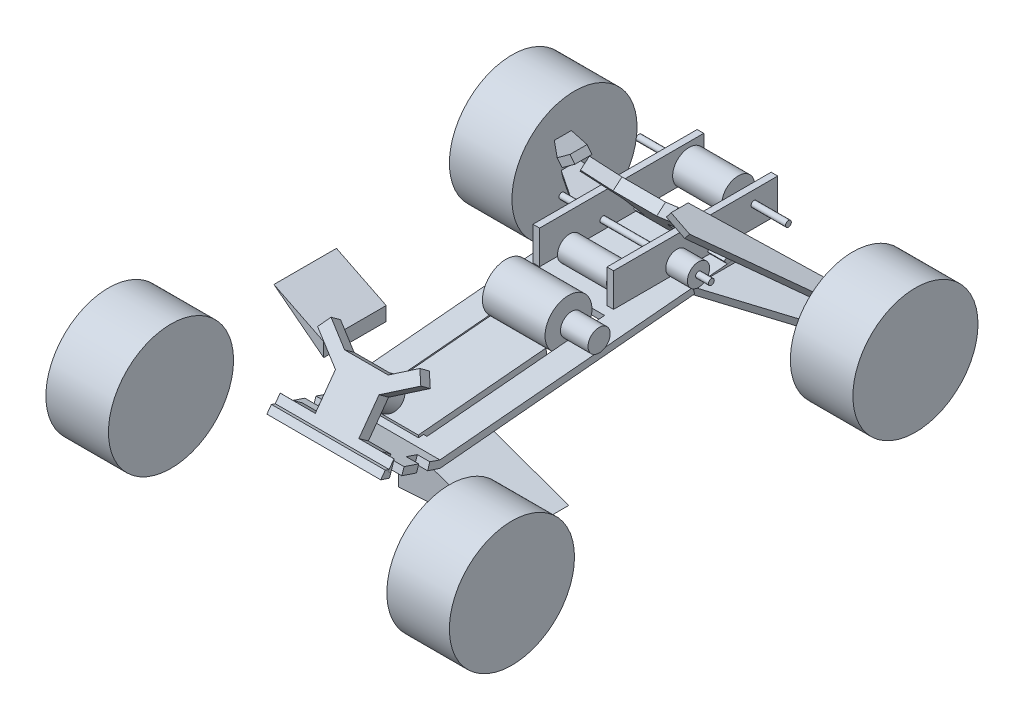
from build123d import *

# Parameters (mm, degrees)
EXTRUDE8_DEPTH    = 50.8
EXTRUDE8_2_DEPTH  = 50.8
EXTRUDE9_START    = 38.1
EXTRUDE9_DEPTH    = 6.35
EXTRUDE10_START   = -111.76
EXTRUDE10_DEPTH   = 6.35
EXTRUDE1_START    = 113.03
SKETCH1_R         = 50.8
EXTRUDE1_DEPTH    = 50.8
EXTRUDE3_DEPTH    = 46.228
EXTRUDE4_START    = -12.7
EXTRUDE4_DEPTH    = 9.525
EXTRUDE5_DEPTH    = 9.525
SKETCH7_W         = 50.8
SKETCH7_H         = 144.78
EXTRUDE6_DEPTH    = 32.131
SKETCH8_R         = 19.05
EXTRUDE7_DEPTH    = 25.4
EXTRUDE11_DEPTH   = 22.606
SKETCH15_R        = 9.84494168
EXTRUDE13_DEPTH   = 19.939
SKETCH15_R_2      = 13.398568769
EXTRUDE13_2_DEPTH = 19.939
EXTRUDE12_START   = 2.54
SKETCH14_R        = 9.017192195
EXTRUDE12_DEPTH   = 22.352
EXTRUDE12_2_DEPTH = 22.352
EXTRUDE14_DEPTH   = 27.178
EXTRUDE14_2_DEPTH = 27.178
SKETCH17_R        = 2.366297188
EXTRUDE15_DEPTH   = 60.706
EXTRUDE15_2_DEPTH = 60.706
SKETCH19_R        = 11.880635855
EXTRUDE16_DEPTH   = 22.86
EXTRUDE17_DEPTH   = 22.86


with BuildPart() as part:
    # Sketch9 → Extrude8 (new body)
    with BuildSketch(Plane.XY):
        Polygon((0, -70.121950413), (0, -33.481008527), (87.527359015, -64.820771167), align=None)
    extrude(amount=EXTRUDE8_DEPTH)


with BuildPart() as body_2:
    # Sketch9 → Extrude8 2 (new body)
    with BuildSketch(Plane.XY):
        Polygon((-101.090313133, 21.664590709), (-60.686282677, -9.621744923), (-60.686282677, 1.656776735), align=None)
    extrude(amount=EXTRUDE8_2_DEPTH)


with BuildPart() as body_3:
    # Sketch10 → Extrude9 (new body)
    with BuildSketch(Plane(origin=(-10.625821763, -29.676361207, 0), x_dir=(0.941469073773161, -0.3370993668470862, 0), z_dir=(0.3370993668470862, 0.941469073773161, 0)).offset(EXTRUDE9_START)):
        Polygon((44.60626445, 142.204013438), (119.420973388, 197.369120583), (119.420973388, 210.76980783), (43.399665669, 181.787484358), align=None)
    extrude(amount=EXTRUDE9_DEPTH)

    # Sketch1 → Extrude1 (add)
    with BuildSketch(Plane(origin=(0, 0, 0), x_dir=(0, 0, -1), z_dir=(1, 0, 0)).offset(EXTRUDE1_START)):
        with Locations((-122.42489779, -27.067109145)):
            Circle(SKETCH1_R)
        with Locations((205.23510221, -27.067109145)):
            Circle(SKETCH1_R)
    extrude(amount=EXTRUDE1_DEPTH)


with BuildPart() as body_4:
    # Sketch11 → Extrude10 (new body)
    with BuildSketch(Plane(origin=(-27.405535431, -35.392258821, 0), x_dir=(0.7906688019939506, -0.6122441061810647, 0), z_dir=(-0.6122441061810647, -0.7906688019939506, 0)).offset(EXTRUDE10_START)):
        Polygon((0, -143.463104662), (96.507508561, -206.193216335), (96.507508561, -193.00380824), (16.084288467, -131.882160969), (0, -129.630310806), align=None)
    extrude(amount=EXTRUDE10_DEPTH)


with BuildPart() as extrude1_piece_1:
    # of the separate pieces the step leaves, piece 1, a body of its own (extrude1_pieces)
    add(body_3.part.solids().sort_by_distance((44.21308259, -8.843132999, -142.204013438))[0])


with BuildPart() as extrude1_piece_2:
    # of the separate pieces the step leaves, piece 2, a body of its own (extrude1_pieces)
    add(body_3.part.solids().sort_by_distance((113.03, -27.067109145, 71.62489779))[0])


with BuildPart() as body_6:
    # Sketch2 → Extrude3 (new, symmetric)
    with BuildSketch(Plane(origin=(0, 0, 0), x_dir=(0, 0, -1), z_dir=(1, 0, 0))):
        Polygon((-111.357617966, -11.826701004), (-63.31745975, -27.778859998), (185.956526111, -4.513651259), (181.787484358, 0.363592119), (-63.31745975, -21.800152827), (-107.711729943, -6.80606157), align=None)
    extrude(amount=EXTRUDE3_DEPTH, both=True)

    # Sketch7 → Extrude6 (cut)
    with BuildSketch(Plane(origin=(0, -15.944265152, -1.441768657), x_dir=(1, 0, 0), z_dir=(0, 0.9959365143393393, 0.09005808906259978))):
        with Locations((0, 17.731907901)):
            Rectangle(SKETCH7_W, SKETCH7_H)
    extrude(amount=-EXTRUDE6_DEPTH, mode=Mode.SUBTRACT)


with BuildPart() as body_7:
    # Mirror1: mirrored copy
    add(extrude1_piece_2.part.mirror(Plane(origin=(0, 0, 0), x_dir=(0, 0, 1), z_dir=(1, 0, 0))))


with BuildPart() as body_8:
    # Mirror1 2: mirrored copy
    add(extrude1_piece_1.part.mirror(Plane(origin=(0, 0, 0), x_dir=(0, 0, 1), z_dir=(1, 0, 0))))


with BuildPart() as body_9:
    # Mirror1 3: mirrored copy
    add(body_4.part.mirror(Plane(origin=(0, 0, 0), x_dir=(0, 0, 1), z_dir=(1, 0, 0))))


with BuildPart() as body_10:
    # Sketch4 → Extrude4 (new body)
    with BuildSketch(Plane(origin=(0, 32.846842942, 78.916583118), x_dir=(1, 0, 0), z_dir=(0, 0.5875932493540642, 0.8091564578704991)).offset(EXTRUDE4_START)):
        Polygon((-46.228, -49.607533798), (-46.228, -41.254783971), (-17.704379343, -41.254783971), (-17.704379343, -13.345481539), (-41.908026413, 3.157767334), (-36.048874465, 11.750793288), (-17.704379343, -0.757394737), (17.704379343, -0.757394737), (36.048874465, 11.750793288), (41.908026413, 3.157767334), (17.704379343, -13.345481539), (17.704379343, -41.254783971), (46.228, -41.254783971), (46.228, -49.607533798), align=None)
    extrude(amount=EXTRUDE4_DEPTH)


with BuildPart() as body_11:
    # Sketch5 → Extrude5 (new body)
    with BuildSketch(Plane(origin=(0, 3.86720885, -178.792611372), x_dir=(-1, 0, 0), z_dir=(0, 0.6497618168388093, -0.7601378699803936))):
        Polygon((-46.228, -2.17309348), (-46.228, 6.179656348), (-17.704379343, 6.179656348), (-17.704379343, 34.08895878), (-41.908026413, 50.592207653), (-36.048874465, 59.185233606), (-17.704379343, 46.677045581), (17.704379343, 46.677045581), (36.048874465, 59.185233606), (41.908026413, 50.592207653), (17.704379343, 34.08895878), (17.704379343, 6.179656348), (46.228, 6.179656348), (46.228, -2.17309348), align=None)
    extrude(amount=-EXTRUDE5_DEPTH)


with BuildPart() as body_12:
    # Sketch8 → Extrude7 (new, symmetric)
    with BuildSketch(Plane(origin=(0, 0, 0), x_dir=(0, 0, -1), z_dir=(1, 0, 0))):
        with Locations((61.903027064, 1.80370738)):
            Circle(SKETCH8_R)
    extrude(amount=EXTRUDE7_DEPTH, both=True)


with BuildPart() as body_13:
    # Sketch13 → Extrude11 (new, symmetric)
    with BuildSketch(Plane(origin=(0, 0, 0), x_dir=(0, 0, -1), z_dir=(1, 0, 0))):
        Polygon((-57.213346612, -19.191342217), (46.503481991, -9.812692822), (47.647219722, -22.461086555), (-56.069608881, -31.839735949), align=None)
    extrude(amount=EXTRUDE11_DEPTH, both=True)


with BuildPart() as body_14:
    # Sketch15 → Extrude13 (new, symmetric)
    with BuildSketch(Plane(origin=(0, 0, 0), x_dir=(0, 0, -1), z_dir=(1, 0, 0))):
        with Locations((108.15059672, 8.465802363)):
            Circle(SKETCH15_R)
    extrude(amount=EXTRUDE13_DEPTH, both=True)


with BuildPart() as body_15:
    # Sketch15 → Extrude13 2 (new, symmetric)
    with BuildSketch(Plane(origin=(0, 0, 0), x_dir=(0, 0, -1), z_dir=(1, 0, 0))):
        with Locations((205.23510221, 17.188741524)):
            Circle(SKETCH15_R_2)
    extrude(amount=EXTRUDE13_2_DEPTH, both=True)


with BuildPart() as body_16:
    # Sketch14 → Extrude12 (new body)
    with BuildSketch(Plane(origin=(25.4, 0, 0), x_dir=(0, 0, -1), z_dir=(1, 0, 0)).offset(EXTRUDE12_START)):
        with Locations((61.903027064, 1.80370738)):
            Circle(SKETCH14_R)
    extrude(amount=EXTRUDE12_DEPTH)


with BuildPart() as body_17:
    # Sketch14 → Extrude12 2 (new body)
    with BuildSketch(Plane(origin=(25.4, 0, 0), x_dir=(0, 0, -1), z_dir=(1, 0, 0)).offset(EXTRUDE12_START)):
        with Locations((142.623751655, 7.584701116)):
            Circle(SKETCH14_R)
    extrude(amount=EXTRUDE12_2_DEPTH)


with BuildPart() as body_18:
    # Sketch16 → Extrude14 (new body)
    with BuildSketch(Plane(origin=(0, 0, 0), x_dir=(1, 0, 0), z_dir=(0, 1, 0))):
        Polygon((32.715575426, 91.227650011), (32.715575426, 224.536762388), (27.349318784, 224.536762388), (27.349318784, 91.197467478), align=None)
    extrude(amount=EXTRUDE14_DEPTH)


with BuildPart() as body_19:
    # Sketch16 → Extrude14 2 (new body)
    with BuildSketch(Plane(origin=(0, 0, 0), x_dir=(1, 0, 0), z_dir=(0, 1, 0))):
        Polygon((-27.349318784, 91.197467478), (-32.715575426, 91.227650011), (-32.715575426, 224.536762388), (-27.349318784, 224.536762388), align=None)
    extrude(amount=EXTRUDE14_2_DEPTH)


with BuildPart() as body_20:
    # Sketch17 → Extrude15 (new, symmetric)
    with BuildSketch(Plane(origin=(0, 0, 0), x_dir=(0, 0, -1), z_dir=(1, 0, 0))):
        with Locations((142.623751655, 7.584701116)):
            Circle(SKETCH17_R)
    extrude(amount=EXTRUDE15_DEPTH, both=True)


with BuildPart() as body_21:
    # Sketch17 → Extrude15 2 (new, symmetric)
    with BuildSketch(Plane(origin=(0, 0, 0), x_dir=(0, 0, -1), z_dir=(1, 0, 0))):
        with Locations((205.23510221, 17.188741524)):
            Circle(SKETCH17_R)
    extrude(amount=EXTRUDE15_2_DEPTH, both=True)


with BuildPart() as body_22:
    # Sketch19 → Extrude16 (new body)
    with BuildSketch(Plane(origin=(0, 41.399732066, 57.01028831), x_dir=(-1, 0, 0), z_dir=(0, -0.5875932493540641, -0.8091564578704991))):
        with Locations(Location((0, -35.110245629, 0), (0, 0, 90))):
            Circle(SKETCH19_R)
    extrude(amount=EXTRUDE16_DEPTH)


with BuildPart() as extrude17_tool:
    # Sketch20 → Extrude17 (new body)
    with BuildSketch(Plane(origin=(0, -43.957133456, 14.596354547), x_dir=(1, 0, 0), z_dir=(0, -0.9490455404212153, 0.31513895698025596))):
        Polygon((54.692263435, 94.518766474), (36.089110401, 94.518766474), (36.089110401, 83.938223186), (48.878778112, 83.938223186), (48.878778112, 71.381094889), (36.089110401, 71.381094889), (36.089110401, 61.846978959), (53.645836077, 61.846978959), align=None)
        Polygon((-53.645836077, 61.846978959), (-54.692263435, 94.518766474), (-36.089110401, 94.518766474), (-36.089110401, 83.938223186), (-48.878778112, 83.938223186), (-48.878778112, 71.381094889), (-36.089110401, 71.381094889), (-36.089110401, 61.846978959), align=None)
    extrude(amount=-EXTRUDE17_DEPTH)


with BuildPart() as body_6_1:
    add(body_6.part)

    # Extrude17: cut by extrude17_tool
    add(extrude17_tool.part, mode=Mode.SUBTRACT)


with BuildPart() as body_10_1:
    add(body_10.part)

    # Extrude17: cut by extrude17_tool
    add(extrude17_tool.part, mode=Mode.SUBTRACT)


solid = Compound([part.part, body_2.part, body_4.part, extrude1_piece_1.part, extrude1_piece_2.part, body_7.part, body_8.part, body_9.part, body_11.part, body_12.part, body_13.part, body_14.part, body_15.part, body_16.part, body_17.part, body_18.part, body_19.part, body_20.part, body_21.part, body_22.part, body_6_1.part, body_10_1.part])
